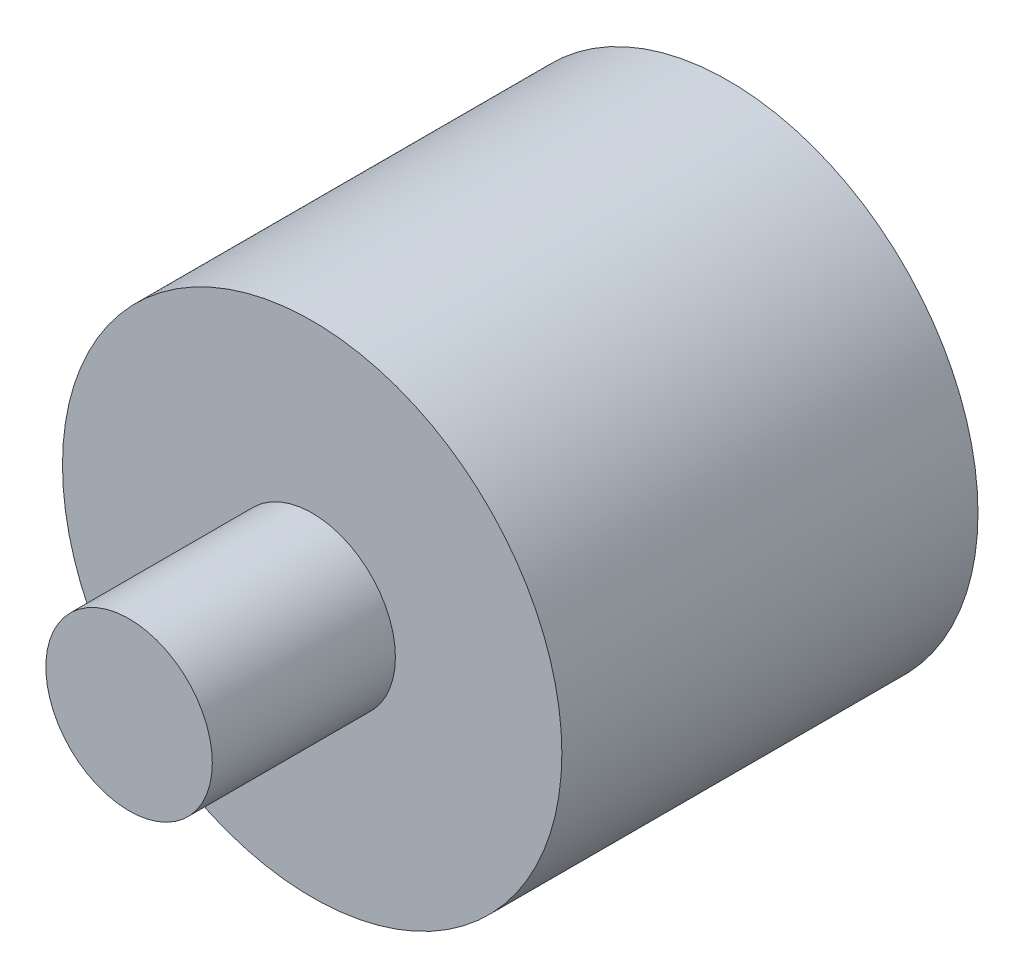
from build123d import *

# Parameters (mm, degrees)
ESQUISSE1_R          = 10
BASE_EXTRUSION_DEPTH = 22
ESQUISSE3_R          = 30
BOSS_EXTRU_1_DEPTH   = 50


with BuildPart() as part:
    # Esquisse1 → Base-Extrusion (new body)
    with BuildSketch(Plane.XY):
        Circle(ESQUISSE1_R)
    extrude(amount=BASE_EXTRUSION_DEPTH)

    # Esquisse3 → Boss.-Extru.1 (add)
    with BuildSketch(Plane(origin=(0, 0, 0), x_dir=(-1, 0, 0), z_dir=(0, 0, -1))):
        Circle(ESQUISSE3_R)
    extrude(amount=BOSS_EXTRU_1_DEPTH)


solid = part.part
